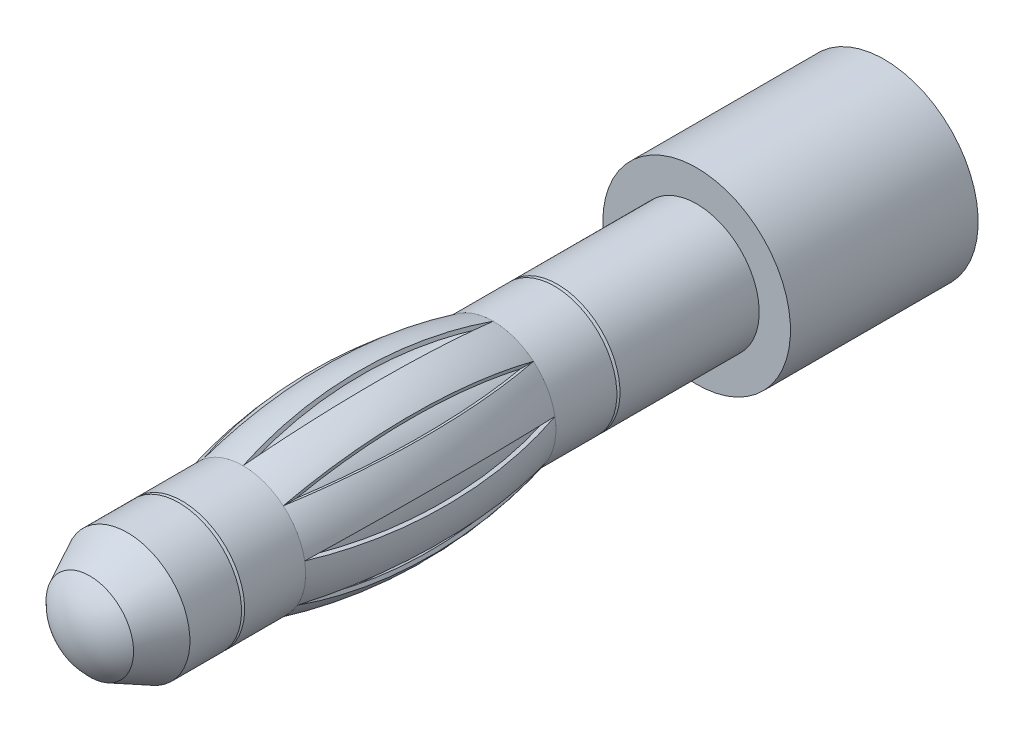
from build123d import *

# Parameters (mm, degrees)
ENL_V_START             = 6
ENL_V_MAT_EXTRU_2_DEPTH = 21.343879745


with BuildPart() as part:
    # Esquisse1 → base (revolve)
    with BuildSketch(Plane(origin=(0, 0, 0), x_dir=(0, 0, -1), z_dir=(1, 0, 0)), mode=Mode.PRIVATE) as base_sk:
        with BuildLine():
            Line((0, 1.55), (0, 3))
            Line((0, 3), (-6, 3))
            Line((-6, 3), (-6, 2))
            Line((-6, 2), (-10.45, 2))
            Line((-10.45, 2), (-10.5, 1.9))
            Line((-10.5, 1.9), (-10.55, 2))
            Line((-10.55, 2), (-12.5, 2))
            ThreePointArc((-12.5, 2), (-16.5, 2.5), (-20.5, 2))
            Line((-20.5, 2), (-22.45, 2))
            Line((-22.45, 2), (-22.5, 1.9))
            Line((-22.5, 1.9), (-22.55, 2))
            Line((-22.55, 2), (-24.2, 2))
            Line((-24.2, 2), (-25.4, 1.4))
            ThreePointArc((-25.4, 1.4), (-25.843680391, 0.761577311), (-26, 0))
            Line((-26, 0), (-7, 0))
            Line((-7, 0), (-7, 0.95))
            Line((-7, 0.95), (-6.7, 1.25))
            Line((-6.7, 1.25), (-0.3, 1.25))
            Line((-0.3, 1.25), (0, 1.55))
        make_face()
        with BuildLine():
            Line((-12.92788578, 2), (-12.92788578, 1.9))
            Line((-12.92788578, 1.9), (-20.07211422, 1.9))
            Line((-20.07211422, 1.9), (-20.07211422, 2))
            ThreePointArc((-20.07211422, 2), (-16.5, 2.4), (-12.92788578, 2))
        make_face(mode=Mode.SUBTRACT)
    revolve(base_sk.sketch.rotate(Axis((0, 0, 0), (0, 0, 1)), 90), axis=Axis((0, 0, 0), (0, 0, 1)))

    # Esquisse2 → Enlèv. mat.-Extru.2 (cut, through all)
    with BuildSketch(Plane.XY.offset(ENL_V_START)):
        Polygon((0.3, 2.5), (-0.3, 2.5), (0, 2), align=None)
        Polygon((1.836782357, 1.722274825), (1.285575219, 1.532088886), (1.377155691, 2.107947391), align=None)
        Polygon((2.514113836, 0.138678118), (1.969615506, 0.347296355), (2.409924929, 0.72956277), align=None)
        Polygon((2.015063509, -1.509807621), (1.732050808, -1), (2.315063509, -0.990192379), align=None)
        Polygon((0.573142572, -2.451837595), (0.684040287, -1.879385242), (1.136958145, -2.246625509), align=None)
        Polygon((-1.136958145, -2.246625509), (-0.684040287, -1.879385242), (-0.573142572, -2.451837595), align=None)
        Polygon((-2.315063509, -0.990192379), (-1.732050808, -1), (-2.015063509, -1.509807621), align=None)
        Polygon((-2.409924929, 0.72956277), (-1.969615506, 0.347296355), (-2.514113836, 0.138678118), align=None)
        Polygon((-1.377155691, 2.107947391), (-1.285575219, 1.532088886), (-1.836782357, 1.722274825), align=None)
    extrude(amount=ENL_V_MAT_EXTRU_2_DEPTH, mode=Mode.SUBTRACT)


solid = part.part
